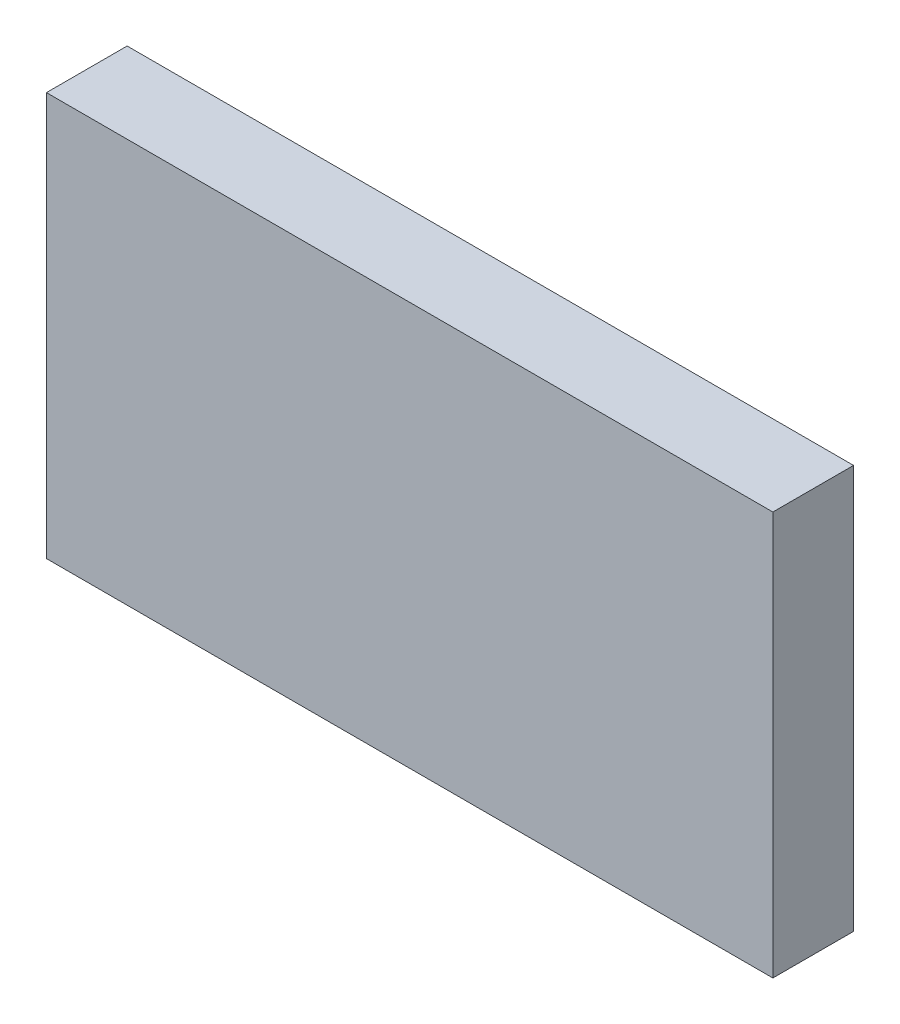
from build123d import *

# Parameters (mm, degrees)
SKETCH1_W      = 90
SKETCH1_H      = 50
EXTRUDE1_DEPTH = 10


with BuildPart() as part:
    # Sketch1 → Extrude1 (new body)
    with BuildSketch(Plane.XY):
        with Locations((45, 25)):
            Rectangle(SKETCH1_W, SKETCH1_H)
    extrude(amount=EXTRUDE1_DEPTH)


solid = part.part
